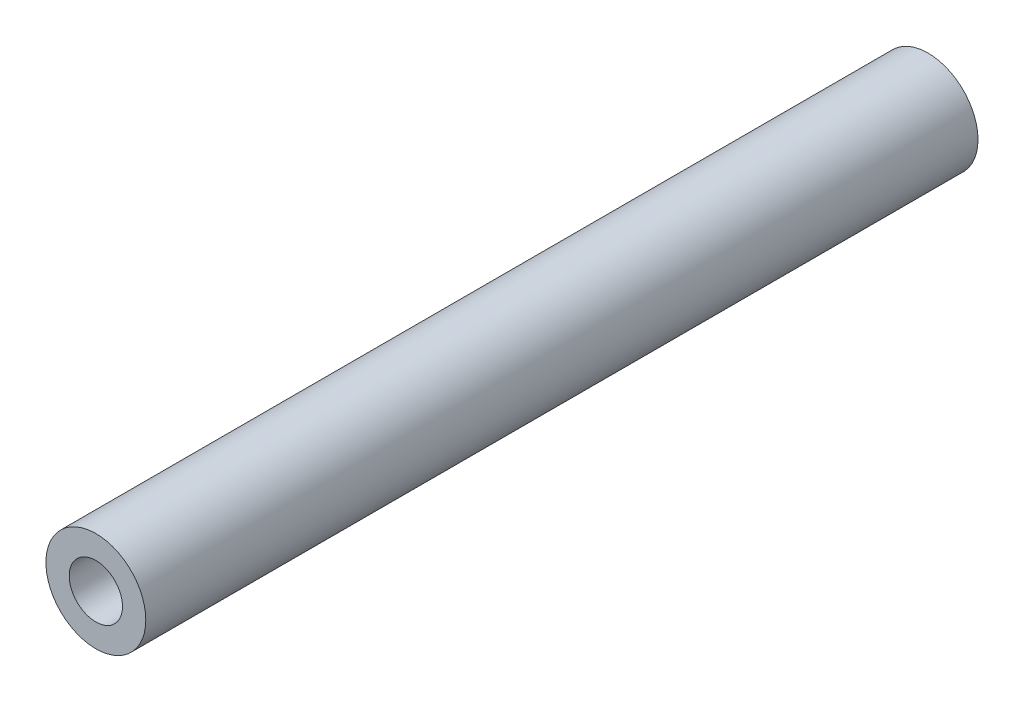
from build123d import *

# Parameters (mm, degrees)
SKETCH_1_R   = 3
SKETCH_1_R_2 = 1.6
F_50MM_DEPTH = 50


with BuildPart() as part:
    # 草图1 → 50mm铝柱 (new body)
    with BuildSketch(Plane.XY):
        Circle(SKETCH_1_R)
        Circle(SKETCH_1_R_2, mode=Mode.SUBTRACT)
    extrude(amount=F_50MM_DEPTH)


solid = part.part
